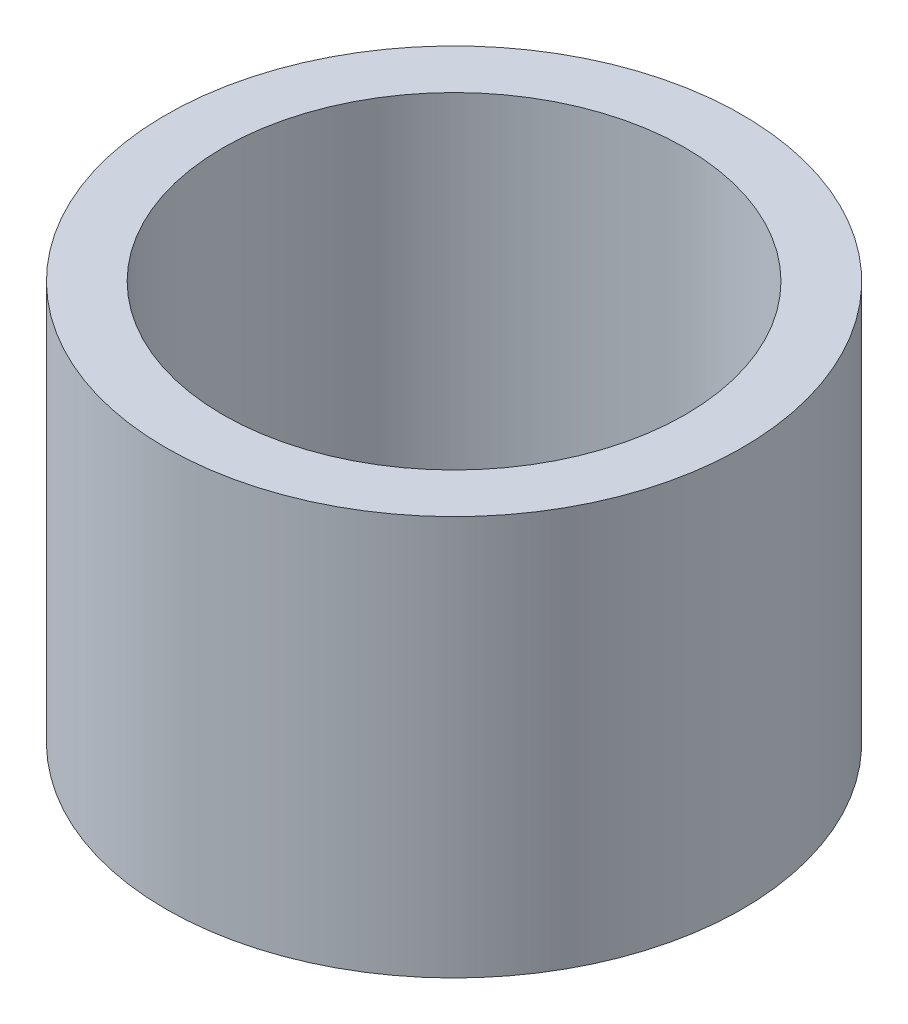
from build123d import *

# Parameters (mm, degrees)
SKETCH1_R           = 5.05
SKETCH1_R_2         = 4.05
BOSS_EXTRUDE1_DEPTH = 7


with BuildPart() as part:
    # Sketch1 → Boss-Extrude1 (new body)
    with BuildSketch(Plane(origin=(0, 0, 0), x_dir=(1, 0, 0), z_dir=(0, 1, 0))):
        with Locations(Location((0, 0, 0), (0, 0, 270))):
            Circle(SKETCH1_R)
        with Locations(Location((0, 0, 0), (0, 0, 270))):
            Circle(SKETCH1_R_2, mode=Mode.SUBTRACT)
    extrude(amount=BOSS_EXTRUDE1_DEPTH)


solid = part.part
